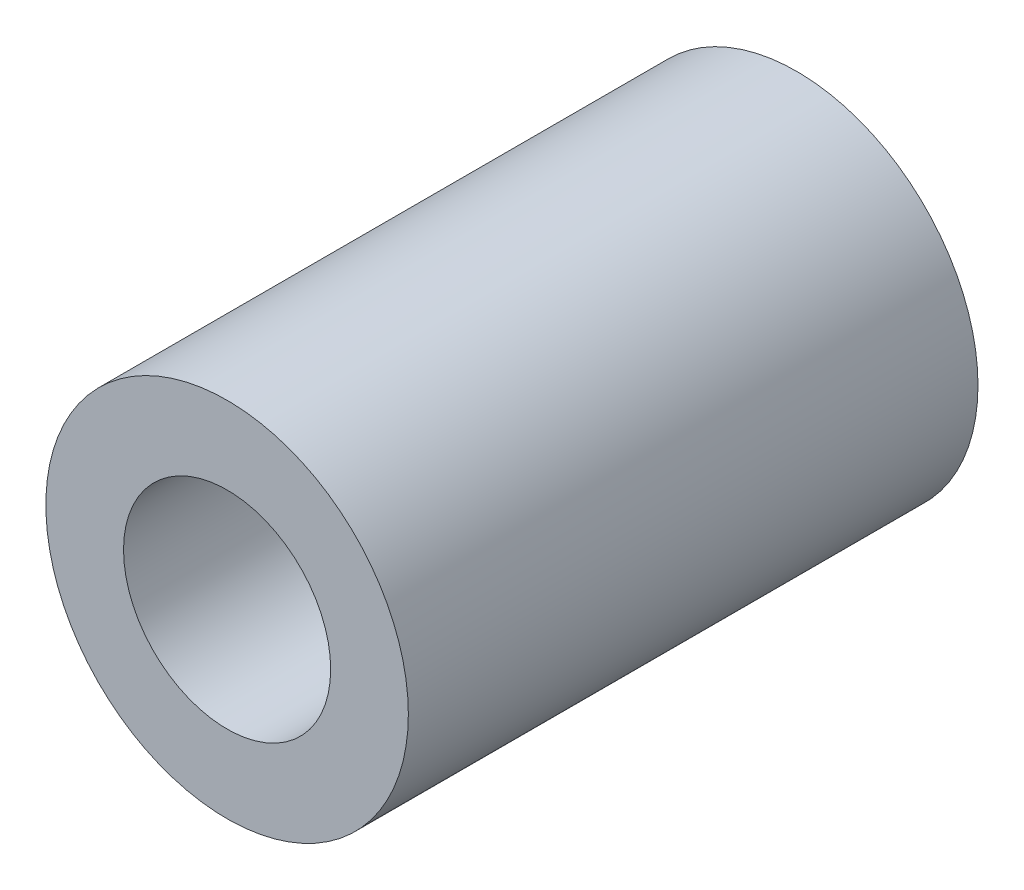
from build123d import *

# Parameters (mm, degrees)
SKETCH_1_R          = 7
SKETCH_1_R_2        = 2.5
EXTRUDE_1_DEPTH     = 22
SKETCH_2_R          = 4
CUT_EXTRUDE_1_DEPTH = 11


with BuildPart() as part:
    # 草图1 → 凸台-拉伸1 (new body)
    with BuildSketch(Plane.XY):
        Circle(SKETCH_1_R)
        Circle(SKETCH_1_R_2, mode=Mode.SUBTRACT)
    extrude(amount=EXTRUDE_1_DEPTH)

    # 草图2 → 切除-拉伸1 (cut)
    with BuildSketch(Plane.XY.offset(22)):
        Circle(SKETCH_2_R)
    extrude(amount=-CUT_EXTRUDE_1_DEPTH, mode=Mode.SUBTRACT)


solid = part.part
